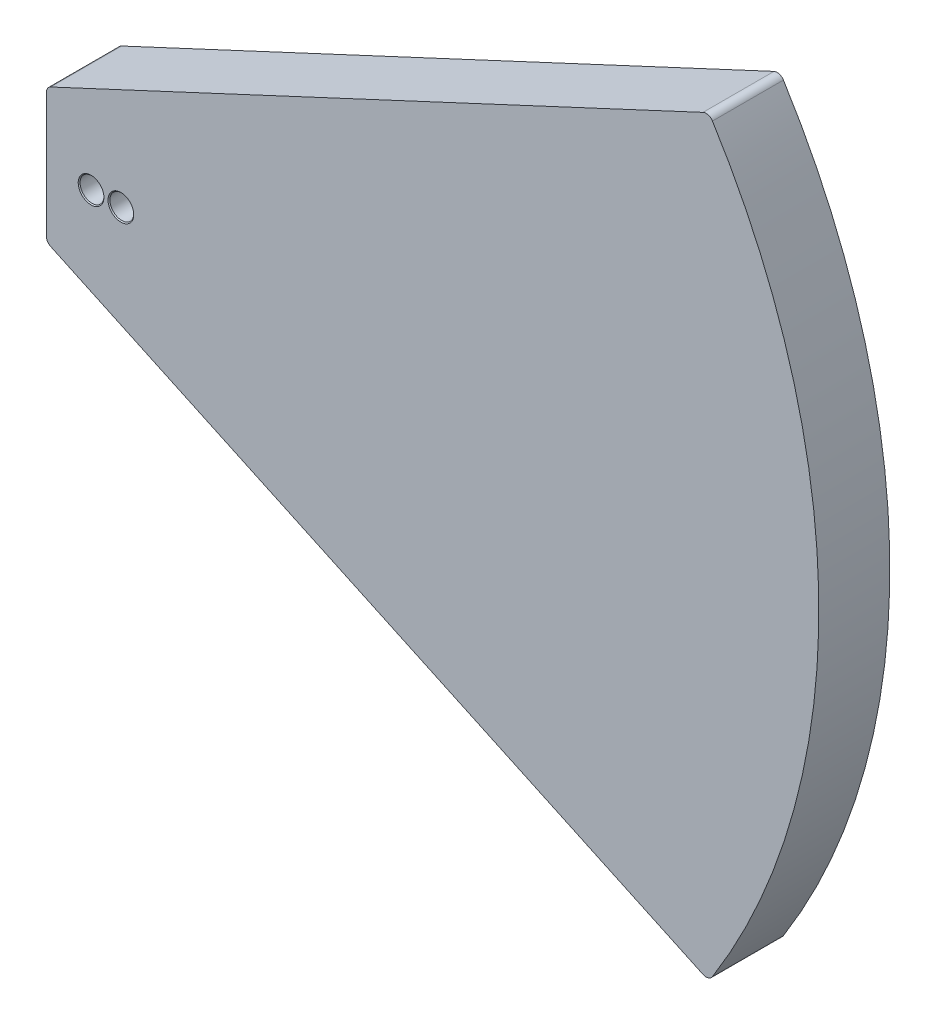
from build123d import *

# Parameters (mm, degrees)
BOSS_EXTRUDE1_DEPTH            = 9.525
CUT_EXTRUDE2_DEPTH             = 4
M3_CLEARANCE_HOLE1_D           = 3.2
M3_CLEARANCE_HOLE1_CSINK_D     = 3.45
M3_CLEARANCE_HOLE1_CSINK_ANGLE = 90
FILLET1_R                      = 1


with BuildPart() as part:
    # Sketch2 → Boss-Extrude1 (new body)
    with BuildSketch(Plane(origin=(0, 0, 0), x_dir=(0, 1, 0), z_dir=(0, 0, 1))):
        with BuildLine():
            Line((-9, 10), (9, 10))
            Line((9, 10), (50.45475081, -78.9))
            ThreePointArc((50.45475081, -78.9), (0, -93.653039883), (-50.45475081, -78.9))
            Line((-50.45475081, -78.9), (-9, 10))
        make_face()
    extrude(amount=BOSS_EXTRUDE1_DEPTH)

    # Sketch3 → Cut-Extrude2 (cut)
    with BuildSketch(Plane(origin=(0, 0, 0), x_dir=(1, 0, 0), z_dir=(0, 0, -1))):
        with BuildLine():
            Line((-10, -4.5), (-10, 4.5))
            Line((-10, 4.5), (0, 4.5))
            ThreePointArc((0, 4.5), (4.5, 0), (0, -4.5))
            Line((0, -4.5), (-10, -4.5))
        make_face()
    extrude(amount=-CUT_EXTRUDE2_DEPTH, mode=Mode.SUBTRACT)

    # M3 Clearance Hole1 (through all)
    with Locations(Plane(origin=(0, 0, 9.525), x_dir=(0, -1, 0), z_dir=(0, 0, 1))):
        with Locations((0, 0), (0, -4)):
            CounterSinkHole(M3_CLEARANCE_HOLE1_D / 2, M3_CLEARANCE_HOLE1_CSINK_D / 2, counter_sink_angle=M3_CLEARANCE_HOLE1_CSINK_ANGLE)

    # Fillet1
    fillet1_edges = [part.edges().sort_by_distance(p)[0] for p in [
        (-10, 4.5, 2),
        (-10, -4.5, 2),
        (-10, -9, 4.7625),
        (-10, 9, 4.7625),
        (78.9, 50.45475081, 4.7625),
        (78.9, -50.45475081, 4.7625),
    ]]
    fillet(fillet1_edges, radius=FILLET1_R)


solid = part.part
